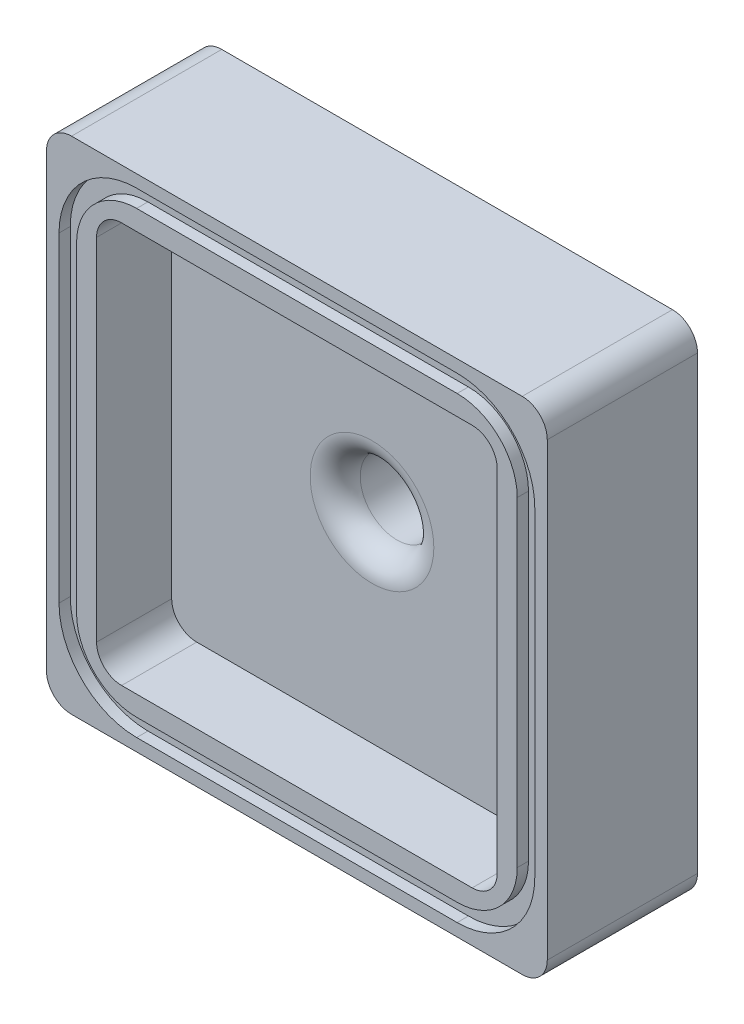
from build123d import *

# Parameters (mm, degrees)
SKETCH1_W                    = 100
SKETCH1_H                    = 100
BOSS_EXTRUDE1_DEPTH          = 30
SKETCH2_W                    = 95
SKETCH2_H                    = 95
CUT_EXTRUDE1_DEPTH           = 2.25
SKETCH3_W                    = 88
SKETCH3_H                    = 88
BOSS_EXTRUDE2_DEPTH          = 2.25
SKETCH4_W                    = 80
SKETCH4_H                    = 80
CUT_EXTRUDE2_DEPTH           = 15
F_9_16_CLEARANCE_HOLE1_D     = 14.7
F_5_16_CLEARANCE_HOLE1_D     = 8.7
F_5_16_CLEARANCE_HOLE1_DEPTH = 30
FILLET1_R                    = 5
FILLET2_R                    = 12
FILLET3_R                    = 15.5


with BuildPart() as part:
    # Sketch1 → Boss-Extrude1 (new body)
    with BuildSketch(Plane.XY.offset(30)):
        with Locations((49.999998297, 50.00000012)):
            Rectangle(SKETCH1_W, SKETCH1_H)
    extrude(amount=-BOSS_EXTRUDE1_DEPTH)

    # Sketch2 → Cut-Extrude1 (cut)
    with BuildSketch(Plane.XY.offset(30)):
        with Locations((49.999998297, 50.00000012)):
            Rectangle(SKETCH2_W, SKETCH2_H)
    extrude(amount=-CUT_EXTRUDE1_DEPTH, mode=Mode.SUBTRACT)

    # Sketch3 → Boss-Extrude2 (add)
    with BuildSketch(Plane.XY.offset(27.75)):
        with Locations((49.999998297, 50.00000012)):
            Rectangle(SKETCH3_W, SKETCH3_H)
    extrude(amount=BOSS_EXTRUDE2_DEPTH)

    # Sketch4 → Cut-Extrude2 (cut)
    with BuildSketch(Plane.XY.offset(30)):
        with Locations((49.999998297, 50.00000012)):
            Rectangle(SKETCH4_W, SKETCH4_H)
    extrude(amount=-CUT_EXTRUDE2_DEPTH, mode=Mode.SUBTRACT)

    # 9/16 Clearance Hole1 (through all)
    with Locations(Plane.XY.offset(15)):
        with Locations((50.000229381, 49.999170193)):
            Hole(F_9_16_CLEARANCE_HOLE1_D / 2)

    # 5/16 Clearance Hole1
    with Locations(Plane(origin=(0, 0, 0), x_dir=(-1, 0, 0), z_dir=(0, 0, -1))):
        with Locations((-79.999998297, 20.00000012)):
            Hole(F_5_16_CLEARANCE_HOLE1_D / 2, depth=F_5_16_CLEARANCE_HOLE1_DEPTH)

    # Fillet1
    fillet1_edges = [part.edges().sort_by_distance(p)[0] for p in [
        (9.999998297, 90.00000012, 22.5),
        (89.999998297, 90.00000012, 22.5),
        (89.999998297, 10.00000012, 22.5),
        (9.999998297, 10.00000012, 22.5),
        (57.350229381, 49.999170193, 15),
        (-1.703e-06, 1.2e-07, 15),
        (-1.703e-06, 100.00000012, 15),
        (99.999998297, 100.00000012, 15),
        (99.999998297, 1.2e-07, 15),
    ]]
    fillet(fillet1_edges, radius=FILLET1_R)

    # Fillet2
    fillet2_edges = [part.edges().sort_by_distance(p)[0] for p in [
        (5.999998297, 6.00000012, 28.875),
        (93.999998297, 6.00000012, 28.875),
        (93.999998297, 94.00000012, 28.875),
        (5.999998297, 94.00000012, 28.875),
    ]]
    fillet(fillet2_edges, radius=FILLET2_R)

    # Fillet3
    fillet3_edges = [part.edges().sort_by_distance(p)[0] for p in [
        (2.499998297, 2.50000012, 28.875),
        (2.499998297, 97.50000012, 28.875),
        (97.499998297, 97.50000012, 28.875),
        (97.499998297, 2.50000012, 28.875),
    ]]
    fillet(fillet3_edges, radius=FILLET3_R)


solid = part.part
